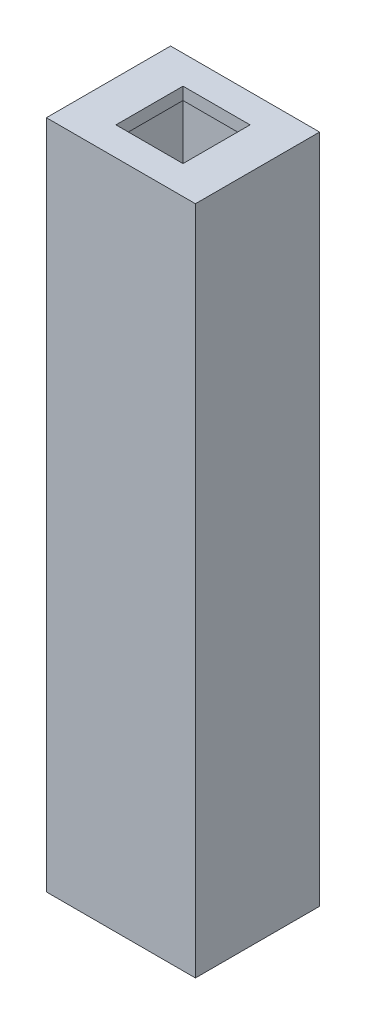
from build123d import *

# Parameters (mm, degrees)
SKETCH_1_W          = 12
SKETCH_1_H          = 10
SKETCH_1_W_2        = 6.2
SKETCH_1_H_2        = 6.2
EXTRUDE_1_DEPTH     = 54
EXTRUDE_START       = 54
SKETCH_1_3_W        = 12
SKETCH_1_3_H        = 10
SKETCH_1_3_W_2      = 6.2
SKETCH_1_3_H_2      = 6.2
SKETCH_1_3_W_3      = 5.4
SKETCH_1_3_H_3      = 5.4
EXTRUDE_2_DEPTH     = 1
SKETCH_2_R          = 0.3
CUT_EXTRUDE_1_DEPTH = 2


with BuildPart() as part:
    # 草图1 → 凸台-拉伸1 (new body)
    with BuildSketch(Plane(origin=(0, 0, 0), x_dir=(1, 0, 0), z_dir=(0, 1, 0))):
        Rectangle(SKETCH_1_W, SKETCH_1_H)
        Rectangle(SKETCH_1_W_2, SKETCH_1_H_2, mode=Mode.SUBTRACT)
    extrude(amount=EXTRUDE_1_DEPTH)

    # 草图1<3> → 凸台-拉伸2 (add)
    # profile 1 of 2: a face of its own
    with BuildSketch(Plane(origin=(0, 0, 0), x_dir=(1, 0, 0), z_dir=(0, 1, 0)).offset(EXTRUDE_START)):
        Rectangle(SKETCH_1_3_W, SKETCH_1_3_H)
        Rectangle(SKETCH_1_3_W_2, SKETCH_1_3_H_2, mode=Mode.SUBTRACT)
    # profile 2 of 2: a face of its own
    with BuildSketch(Plane(origin=(0, 0, 0), x_dir=(1, 0, 0), z_dir=(0, 1, 0)).offset(EXTRUDE_START)):
        Rectangle(SKETCH_1_3_W_2, SKETCH_1_3_H_2)
        Rectangle(SKETCH_1_3_W_3, SKETCH_1_3_H_3, mode=Mode.SUBTRACT)
    extrude(amount=-EXTRUDE_2_DEPTH)

    # 草图2 → 切除-拉伸1 (cut)
    with BuildSketch(Plane.XZ):
        with Locations(Location((-4.5, 3.5, 0), (0, 0, 270))):
            Circle(SKETCH_2_R)
        with Locations(Location((4.5, -3.5, 0), (0, 0, 270))):
            Circle(SKETCH_2_R)
        with Locations(Location((4.5, 3.5, 0), (0, 0, 270))):
            Circle(SKETCH_2_R)
        with Locations(Location((-4.5, -3.5, 0), (0, 0, 270))):
            Circle(SKETCH_2_R)
    extrude(amount=-CUT_EXTRUDE_1_DEPTH, mode=Mode.SUBTRACT)


solid = part.part
